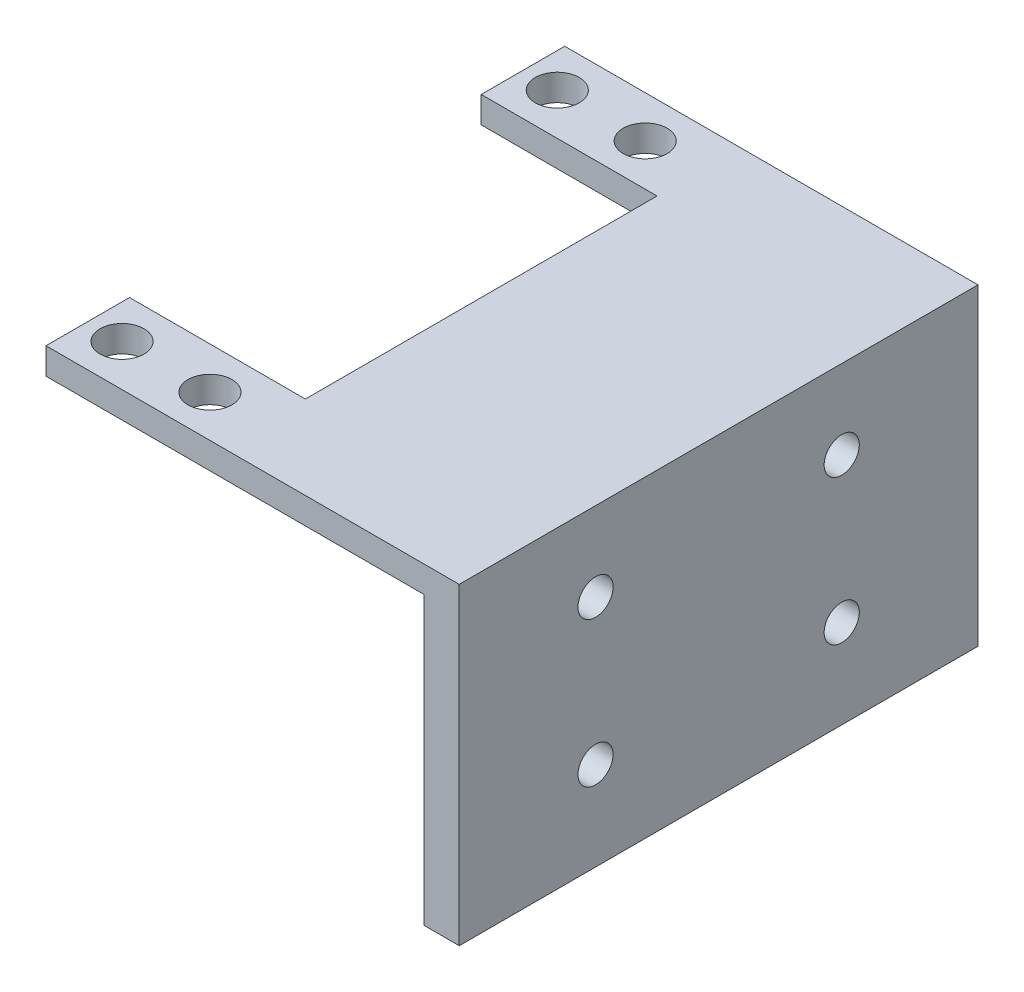
from build123d import *

# Parameters (mm, degrees)
SKETCH_1_W          = 47
SKETCH_1_H          = 35.6
EXTRUDE_1_DEPTH     = 59
SKETCH_3_W          = 59
SKETCH_3_H          = 32.6
CUT_EXTRUDE_1_DEPTH = 43
SKETCH_4_R          = 2.5
SKETCH_4_W          = 20
SKETCH_4_H          = 40
CUT_EXTRUDE_2_DEPTH = 49
SKETCH_6_R          = 2
CUT_EXTRUDE_3_DEPTH = 10


with BuildPart() as part:
    # 草图1 → 凸台-拉伸1 (new body)
    with BuildSketch(Plane.XY):
        with Locations((23.5, 17.8)):
            Rectangle(SKETCH_1_W, SKETCH_1_H)
    extrude(amount=EXTRUDE_1_DEPTH)

    # 草图3 → 切除-拉伸1 (cut)
    with BuildSketch(Plane.ZY):
        with Locations((29.5, 16.3)):
            Rectangle(SKETCH_3_W, SKETCH_3_H)
    extrude(amount=-CUT_EXTRUDE_1_DEPTH, mode=Mode.SUBTRACT)

    # 草图4 → 切除-拉伸2 (cut)
    with BuildSketch(Plane.XZ.offset(-32.6)):
        with Locations(Location((3.9, 54.25, 0), (0, 0, 270))):
            Circle(SKETCH_4_R)
        with Locations(Location((13.9, 54.25, 0), (0, 0, 270))):
            Circle(SKETCH_4_R)
        with Locations(Location((13.9, 4.75, 0), (0, 0, 270))):
            Circle(SKETCH_4_R)
        with Locations(Location((3.9, 4.75, 0), (0, 0, 270))):
            Circle(SKETCH_4_R)
        with Locations((10, 29.5)):
            Rectangle(SKETCH_4_W, SKETCH_4_H)
    extrude(amount=-CUT_EXTRUDE_2_DEPTH, mode=Mode.SUBTRACT)

    # 草图6 → 切除-拉伸3 (cut)
    with BuildSketch(Plane.ZY.offset(-43)):
        with Locations((43.5, 26.6)):
            Circle(SKETCH_6_R)
        with Locations((15.5, 26.6)):
            Circle(SKETCH_6_R)
        with Locations((43.5, 10.1)):
            Circle(SKETCH_6_R)
        with Locations((15.5, 10.1)):
            Circle(SKETCH_6_R)
    extrude(amount=-CUT_EXTRUDE_3_DEPTH, mode=Mode.SUBTRACT)


solid = part.part
